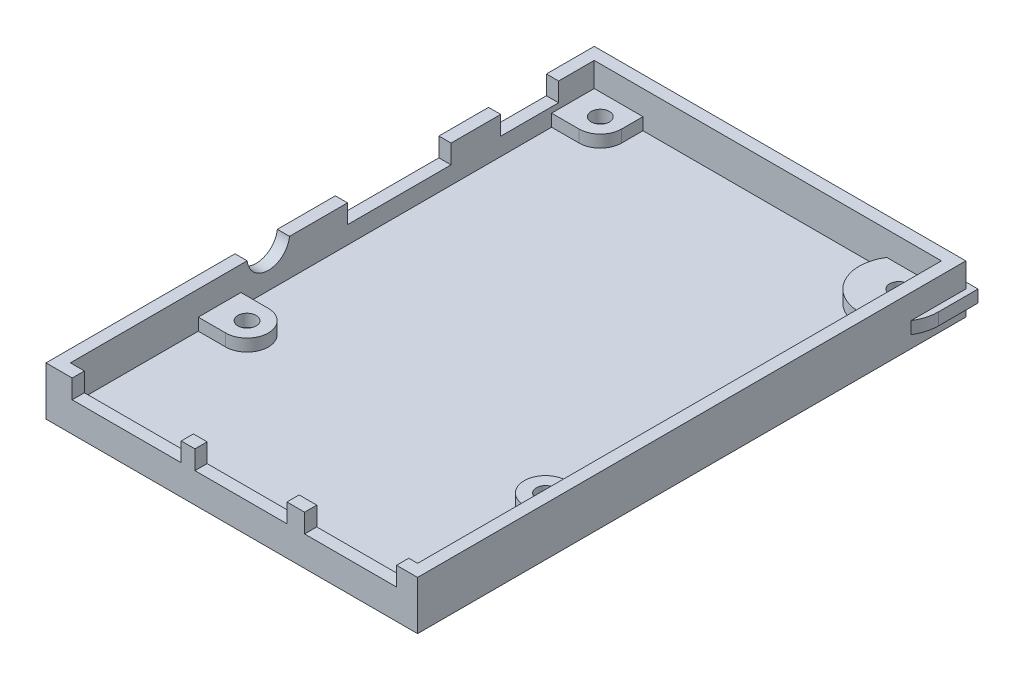
from build123d import *

# Parameters (mm, degrees)
SKETCH1_W            = 61
SKETCH1_H            = 90
BOSS_EXTRUDE1_DEPTH  = 8
SKETCH4_W            = 57
SKETCH4_H            = 86
CUT_EXTRUDE1_DEPTH   = 6
SKETCH5_R            = 1.5
BOSS_EXTRUDE12_DEPTH = 2
CUT_EXTRUDE2_REACH   = 79.614
SKETCH6_R            = 3.5
SKETCH6_W            = 17
SKETCH6_H            = 6.5
SKETCH6_W_2          = 9.5
SKETCH6_H_2          = 4
CUT_EXTRUDE3_REACH   = 98.629
SKETCH8_W            = 17.9
SKETCH8_H            = 15.5
SKETCH8_W_2          = 15.1
SKETCH8_H_2          = 16


with BuildPart() as part:
    # Sketch1 → Boss-Extrude1 (new body)
    with BuildSketch(Plane(origin=(0, 0, 0), x_dir=(1, 0, 0), z_dir=(0, 1, 0))):
        Rectangle(SKETCH1_W, SKETCH1_H)
    extrude(amount=BOSS_EXTRUDE1_DEPTH)

    # Sketch4 → Cut-Extrude1 (cut)
    with BuildSketch(Plane(origin=(0, 2, 0), x_dir=(1, 0, 0), z_dir=(0, 1, 0))):
        Rectangle(SKETCH4_W, SKETCH4_H)
    extrude(amount=CUT_EXTRUDE1_DEPTH, mode=Mode.SUBTRACT)

    # Sketch5 → Boss-Extrude12 (add)
    # profile 1 of 4: a face of its own
    with BuildSketch(Plane(origin=(0, 2, 0), x_dir=(1, 0, 0), z_dir=(0, 1, 0))):
        with BuildLine():
            Line((25, -15), (28.5, -15))
            Line((28.5, -15), (28.5, -22))
            Line((28.5, -22), (25, -22))
            ThreePointArc((25, -22), (21.5, -18.5), (25, -15))
        make_face()
        with Locations(Location((25, -18.5, 0), (0, 0, 270))):
            Circle(SKETCH5_R, mode=Mode.SUBTRACT)
    # profile 2 of 4: a face of its own
    with BuildSketch(Plane(origin=(0, 2, 0), x_dir=(1, 0, 0), z_dir=(0, 1, 0))):
        with BuildLine():
            Line((31.5, 39.5), (31.5, 46))
            Line((31.5, 46), (25, 46))
            ThreePointArc((25, 46), (20.403805922, 34.903805922), (31.5, 39.5))
        make_face()
        with Locations(Location((25, 39.5, 0), (0, 0, 270))):
            Circle(SKETCH5_R, mode=Mode.SUBTRACT)
    # profile 3 of 4: a face of its own
    with BuildSketch(Plane(origin=(0, 2, 0), x_dir=(1, 0, 0), z_dir=(0, 1, 0))):
        with BuildLine():
            Line((-20.5, 39.5), (-20.5, 43))
            Line((-20.5, 43), (-28.5, 43))
            Line((-28.5, 43), (-28.5, 36))
            Line((-28.5, 36), (-24, 36))
            ThreePointArc((-24, 36), (-21.525126266, 37.025126266), (-20.5, 39.5))
        make_face()
        with Locations(Location((-24, 39.5, 0), (0, 0, 90))):
            Circle(SKETCH5_R, mode=Mode.SUBTRACT)
    # profile 4 of 4: a face of its own
    with BuildSketch(Plane(origin=(0, 2, 0), x_dir=(1, 0, 0), z_dir=(0, 1, 0))):
        with BuildLine():
            Line((-24, -15), (-28.506473373, -15))
            Line((-28.506473373, -15), (-28.5, -22))
            Line((-28.5, -22), (-24, -22))
            ThreePointArc((-24, -22), (-20.5, -18.5), (-24, -15))
        make_face()
        with Locations(Location((-24, -18.5, 0), (0, 0, 270))):
            Circle(SKETCH5_R, mode=Mode.SUBTRACT)
    extrude(amount=BOSS_EXTRUDE12_DEPTH)

    # Sketch6 → Cut-Extrude2 (cut, up to next)
    with BuildSketch(Plane.ZY.offset(30.5), mode=Mode.PRIVATE) as cut_extrude2_sk1:
        with Locations((10.5, 8.4)):
            Circle(SKETCH6_R)
    cut_extrude2_tool1 = extrude(cut_extrude2_sk1.sketch, amount=-CUT_EXTRUDE2_REACH, mode=Mode.PRIVATE) & part.part
    # Sketch6 → Cut-Extrude2 (cut, up to next)
    with BuildSketch(Plane.ZY.offset(30.5), mode=Mode.PRIVATE) as cut_extrude2_sk2:
        with Locations((-11, 8.15)):
            Rectangle(SKETCH6_W, SKETCH6_H)
    cut_extrude2_tool2 = extrude(cut_extrude2_sk2.sketch, amount=-CUT_EXTRUDE2_REACH, mode=Mode.PRIVATE) & part.part
    # Sketch6 → Cut-Extrude2 (cut, up to next)
    with BuildSketch(Plane.ZY.offset(30.5), mode=Mode.PRIVATE) as cut_extrude2_sk3:
        with Locations((-32.4, 6.9)):
            Rectangle(SKETCH6_W_2, SKETCH6_H_2)
    cut_extrude2_tool3 = extrude(cut_extrude2_sk3.sketch, amount=-CUT_EXTRUDE2_REACH, mode=Mode.PRIVATE) & part.part
    add(cut_extrude2_tool1.solids().sort_by_distance((-30.5, 8.4, 10.5))[0], mode=Mode.SUBTRACT)
    add(cut_extrude2_tool2.solids().sort_by_distance((-30.5, 8.15, -11))[0], mode=Mode.SUBTRACT)
    add(cut_extrude2_tool3.solids().sort_by_distance((-30.5, 6.9, -32.4))[0], mode=Mode.SUBTRACT)

    # Sketch8 → Cut-Extrude3 (cut, up to next)
    with BuildSketch(Plane.XY.offset(45), mode=Mode.PRIVATE) as cut_extrude3_sk1:
        with Locations((-17.25, 12.65)):
            Rectangle(SKETCH8_W, SKETCH8_H)
    cut_extrude3_tool1 = extrude(cut_extrude3_sk1.sketch, amount=-CUT_EXTRUDE3_REACH, mode=Mode.PRIVATE) & part.part
    # Sketch8 → Cut-Extrude3 (cut, up to next)
    with BuildSketch(Plane.XY.offset(45), mode=Mode.PRIVATE) as cut_extrude3_sk2:
        with Locations((1.5, 12.9)):
            Rectangle(SKETCH8_W_2, SKETCH8_H_2)
    cut_extrude3_tool2 = extrude(cut_extrude3_sk2.sketch, amount=-CUT_EXTRUDE3_REACH, mode=Mode.PRIVATE) & part.part
    # Sketch8 → Cut-Extrude3 (cut, up to next)
    with BuildSketch(Plane.XY.offset(45), mode=Mode.PRIVATE) as cut_extrude3_sk3:
        with Locations((19.5, 12.9)):
            Rectangle(SKETCH8_W_2, SKETCH8_H_2)
    cut_extrude3_tool3 = extrude(cut_extrude3_sk3.sketch, amount=-CUT_EXTRUDE3_REACH, mode=Mode.PRIVATE) & part.part
    add(cut_extrude3_tool1.solids().sort_by_distance((-17.25, 12.65, 45))[0], mode=Mode.SUBTRACT)
    add(cut_extrude3_tool2.solids().sort_by_distance((1.5, 12.9, 45))[0], mode=Mode.SUBTRACT)
    add(cut_extrude3_tool3.solids().sort_by_distance((19.5, 12.9, 45))[0], mode=Mode.SUBTRACT)


solid = part.part
